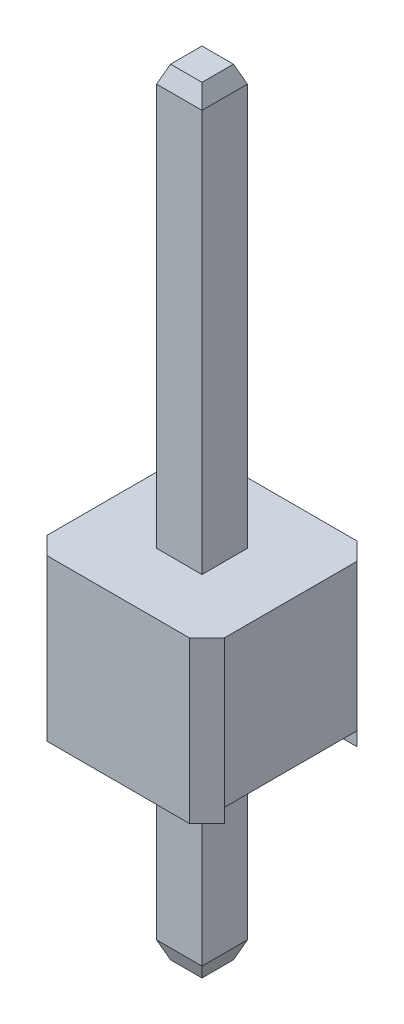
from build123d import *

# Parameters (mm, degrees)
SALIENTE_EXTRUIR1_DEPTH = 2.1
SALIENTE_EXTRUIR2_DEPTH = 0.2
SALIENTE_EXTRUIR3_DEPTH = 0.2
CROQUIS4_W              = 0.65
CROQUIS4_H              = 0.65
SALIENTE_EXTRUIR4_DEPTH = 3
CROQUIS5_W              = 0.65
CROQUIS5_H              = 0.65
SALIENTE_EXTRUIR5_DEPTH = 6
CHAFL_N1_SIZE           = 0.25
CHAFL_N2_SIZE           = 0.1
CHAFL_N2_SIZE2          = 0.247508685
CHAFL_N3_SIZE           = 0.1
CHAFL_N3_SIZE2          = 0.247508685


with BuildPart() as part:
    # Croquis1 → Saliente-Extruir1 (new body)
    with BuildSketch(Plane.XZ.offset(-3.2)):
        Polygon((-0.945, 1.525), (-0.945, -0.625), (-0.695, -0.875), (1.595, -0.875), (1.595, 1.275), (1.345, 1.525), align=None)
    extrude(amount=-SALIENTE_EXTRUIR1_DEPTH)

    # Croquis2 → Saliente-Extruir2 (add)
    with BuildSketch(Plane.XZ.offset(-3.2)):
        Polygon((-0.945, 1.525), (1.345, 1.525), (1.595, 1.275), (-0.945, 1.275), align=None)
    extrude(amount=SALIENTE_EXTRUIR2_DEPTH)

    # Croquis3 → Saliente-Extruir3 (add)
    with BuildSketch(Plane.XZ.offset(-3.2)):
        Polygon((1.595, -0.875), (-0.695, -0.875), (-0.945, -0.625), (1.595, -0.625), align=None)
    extrude(amount=SALIENTE_EXTRUIR3_DEPTH)

    # Chaflán1
    chafl_n1_edges = [part.edges().sort_by_distance(p)[0] for p in [
        (-0.945, 4.15, 1.525),
        (1.595, 4.15, -0.875),
    ]]
    chamfer(chafl_n1_edges, length=CHAFL_N1_SIZE)


with BuildPart() as body_2:
    # Croquis4 → Saliente-Extruir4 (new body)
    with BuildSketch(Plane.XZ.offset(-3.2)):
        with Locations((0.325, 0.325)):
            Rectangle(CROQUIS4_W, CROQUIS4_H)
    extrude(amount=SALIENTE_EXTRUIR4_DEPTH)

    # Chaflán2
    chafl_n2_edges = [body_2.edges().sort_by_distance(p)[0] for p in [
        (0.325, 0.2, 0),
        (0.65, 0.2, 0.325),
        (0.325, 0.2, 0.65),
        (0, 0.2, 0.325),
    ]]
    chafl_n2_side = [body_2.faces().sort_by_distance(p)[0] for p in [
        (0.325, 0.2, 0.325),
    ]]
    chamfer(chafl_n2_edges, length=CHAFL_N2_SIZE, length2=CHAFL_N2_SIZE2, reference=chafl_n2_side[0])


with BuildPart() as body_3:
    # Croquis5 → Saliente-Extruir5 (new body)
    with BuildSketch(Plane(origin=(0, 5.3, 0), x_dir=(-1, 0, 0), z_dir=(0, 1, 0))):
        with Locations((-0.325, 0.325)):
            Rectangle(CROQUIS5_W, CROQUIS5_H)
    extrude(amount=SALIENTE_EXTRUIR5_DEPTH)

    # Chaflán3
    chafl_n3_edges = [body_3.edges().sort_by_distance(p)[0] for p in [
        (0.325, 11.3, 0),
        (0, 11.3, 0.325),
        (0.325, 11.3, 0.65),
        (0.65, 11.3, 0.325),
    ]]
    chafl_n3_side = [body_3.faces().sort_by_distance(p)[0] for p in [
        (0.325, 11.3, 0.325),
    ]]
    chamfer(chafl_n3_edges, length=CHAFL_N3_SIZE, length2=CHAFL_N3_SIZE2, reference=chafl_n3_side[0])


solid = Compound([part.part, body_2.part, body_3.part])
